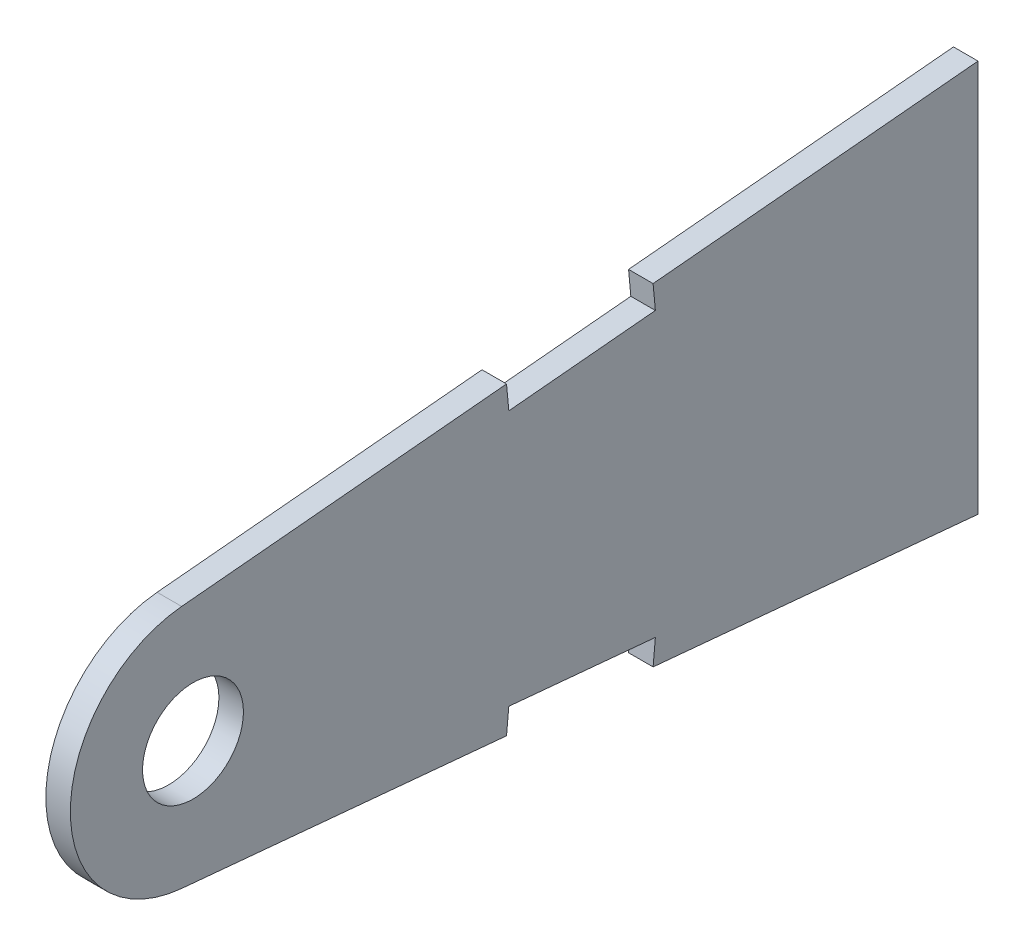
from build123d import *

# Parameters (mm, degrees)
BOSS_EXTRUDE1_DEPTH     = 1.5875
F_1_4_CLEARANCE_HOLE1_D = 6.5278


with BuildPart() as part:
    # Sketch1 → Boss-Extrude1 (new body)
    with BuildSketch(Plane(origin=(0, 0, 0), x_dir=(0, 0, -1), z_dir=(1, 0, 0))):
        with BuildLine():
            ThreePointArc((-0.735600854, 7.903340916), (-5.86697273, 5.346263858), (-7.9375, 0))
            Line((-7.9375, 0), (50.8, 0))
            Line((50.8, 0), (50.8, 12.7))
            Line((50.8, 12.7), (29.774204123, 10.74303097))
            Line((29.774204123, 10.74303097), (29.921324293, 9.162362787))
            Line((29.921324293, 9.162362787), (20.437315194, 8.279641762))
            Line((20.437315194, 8.279641762), (20.290195023, 9.860309946))
            Line((20.290195023, 9.860309946), (-0.735600854, 7.903340916))
        make_face()
        with BuildLine():
            ThreePointArc((-7.9375, 0), (-5.86697273, -5.346263858), (-0.735600854, -7.903340916))
            Line((-0.735600854, -7.903340916), (20.290195023, -9.860309946))
            Line((20.290195023, -9.860309946), (20.437315194, -8.279641762))
            Line((20.437315194, -8.279641762), (29.921324293, -9.162362787))
            Line((29.921324293, -9.162362787), (29.774204123, -10.74303097))
            Line((29.774204123, -10.74303097), (50.8, -12.7))
            Line((50.8, -12.7), (50.8, 0))
            Line((50.8, 0), (-7.9375, 0))
        make_face()
    extrude(amount=BOSS_EXTRUDE1_DEPTH)

    # 1/4 Clearance Hole1 (through all)
    with Locations(Plane(origin=(1.5875, 0, 0), x_dir=(0, 0, -1), z_dir=(1, 0, 0))):
        with Locations((0, 0)):
            Hole(F_1_4_CLEARANCE_HOLE1_D / 2)


solid = part.part
